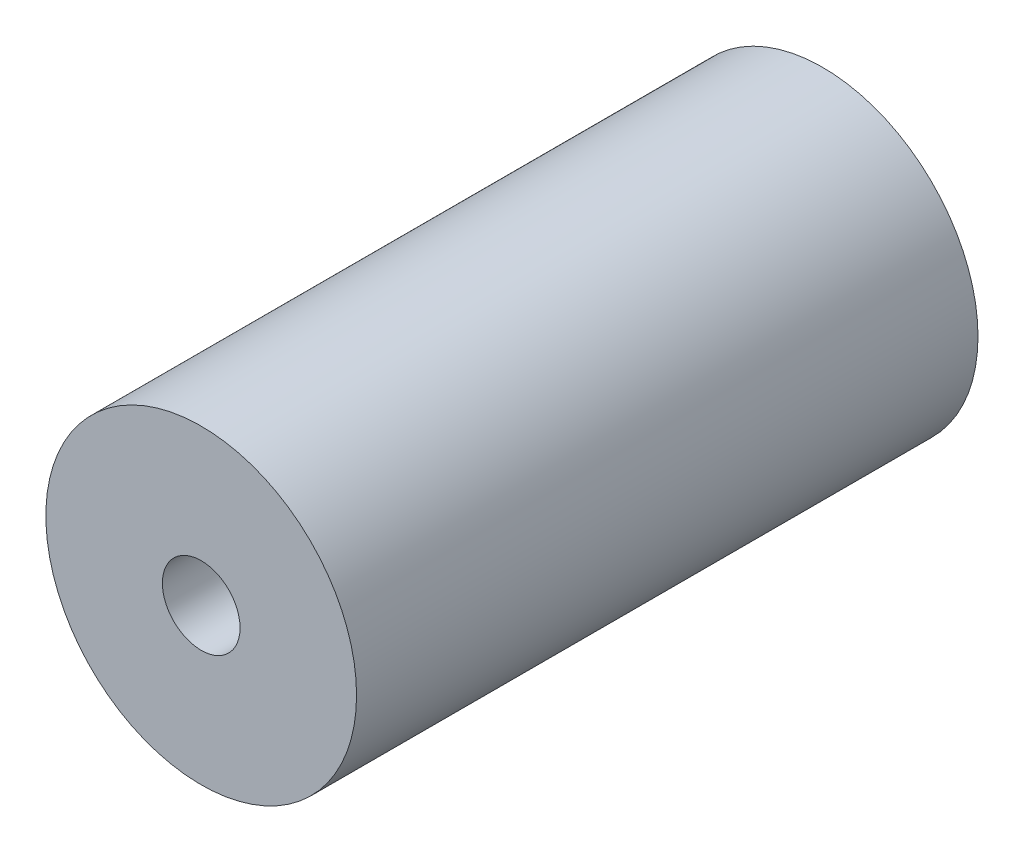
from build123d import *

# Parameters (mm, degrees)
SKETCH1_R           = 5
BOSS_EXTRUDE1_DEPTH = 10
SKETCH2_R           = 5
SKETCH2_R_2         = 1.25
BOSS_EXTRUDE2_DEPTH = 10


with BuildPart() as part:
    # Sketch1 → Boss-Extrude1 (new body)
    with BuildSketch(Plane.XY):
        Circle(SKETCH1_R)
        with BuildLine():
            Line((-1.072430112, -0.899940917), (-0.831301536, -0.9))
            Line((-0.831301536, -0.9), (0.831568399, -0.9))
            Line((0.831568399, -0.9), (1.07238053, -0.899999999))
            ThreePointArc((1.07238053, -0.899999999), (0.478887909, 1.315547936), (-1.4, 0))
            ThreePointArc((-1.4, 0), (-1.315561127, -0.478851669), (-1.072430112, -0.899940917))
        make_face(mode=Mode.SUBTRACT)
    extrude(amount=BOSS_EXTRUDE1_DEPTH)

    # Sketch2 → Boss-Extrude2 (add)
    with BuildSketch(Plane.XY.offset(10)):
        Circle(SKETCH2_R)
        Circle(SKETCH2_R_2, mode=Mode.SUBTRACT)
    extrude(amount=BOSS_EXTRUDE2_DEPTH)


solid = part.part
